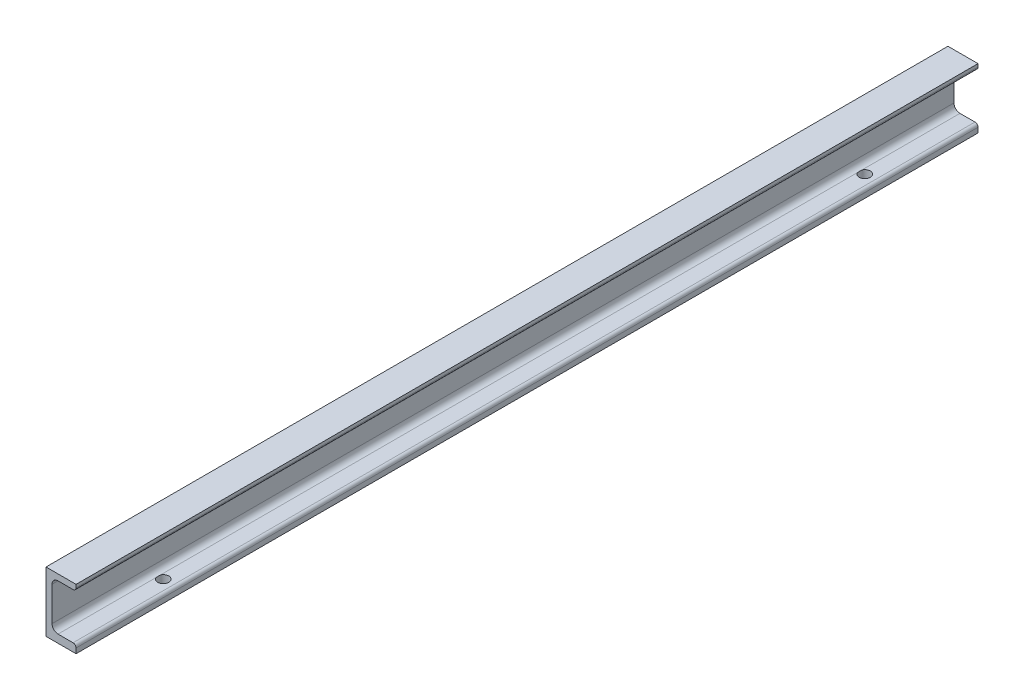
from build123d import *

# Parameters (mm, degrees)
BOSS_EXTRUDE1_DEPTH = 450
SKETCH2_R           = 5.5
CUT_EXTRUDE1_DEPTH  = 10


with BuildPart() as part:
    # Sketch1 → Boss-Extrude1 (new, symmetric)
    with BuildSketch(Plane.XY):
        with BuildLine():
            Line((12, 24), (-3, 24))
            ThreePointArc((-3, 24), (-7.242640687, 22.242640687), (-9, 18))
            Line((-9, 18), (-9, -16))
            ThreePointArc((-9, -16), (-7.242640687, -20.242640687), (-3, -22))
            Line((-3, -22), (12, -22))
            ThreePointArc((12, -22), (14.121320344, -22.878679656), (15, -25))
            Line((15, -25), (15, -30))
            Line((15, -30), (-15, -30))
            Line((-15, -30), (-15, 30))
            Line((-15, 30), (15, 30))
            Line((15, 30), (15, 27))
            ThreePointArc((15, 27), (14.121320344, 24.878679656), (12, 24))
        make_face()
    extrude(amount=BOSS_EXTRUDE1_DEPTH, both=True)

    # Sketch2 → Cut-Extrude1 (cut)
    with BuildSketch(Plane(origin=(0, -22, 0), x_dir=(1, 0, 0), z_dir=(0, 1, 0))):
        with Locations(Location((2, -350, 0), (0, 0, 204.619977329))):
            Circle(SKETCH2_R)
    cut_extrude1 = extrude(amount=-CUT_EXTRUDE1_DEPTH, mode=Mode.SUBTRACT)

    # Mirror1: Cut-Extrude1 across plane
    add(cut_extrude1.mirror(Plane.XY), mode=Mode.SUBTRACT)


solid = part.part
